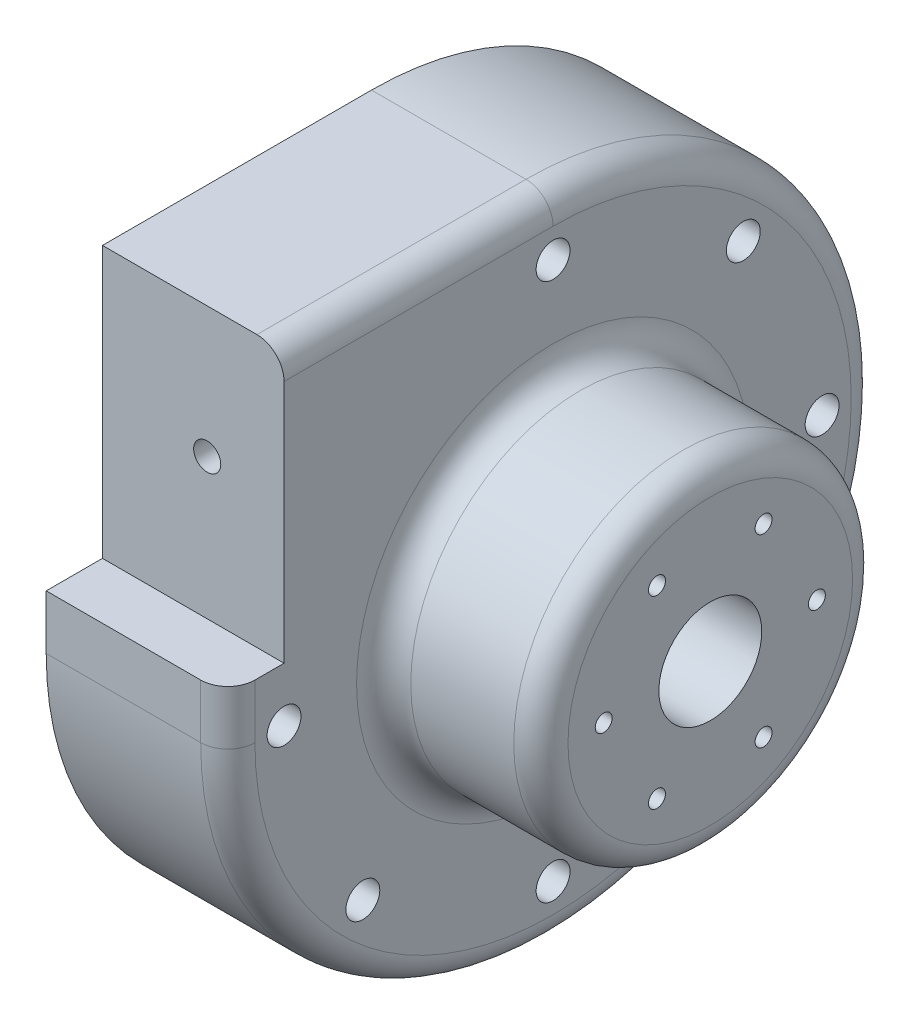
from build123d import *

# Parameters (mm, degrees)
HOUSING_2_DEPTH          = 44.45
SKETCH2_R                = 39.878
IMPELLER_CUT_DEPTH       = 22.4028
SKETCH4_R                = 9.641475923
INLET_CUT_DEPTH          = 19.8628
SKETCH6_R                = 3.175
FASTENER_BORE_DEPTH      = 116.84
FASTENER_PATTERN_COUNT   = 8
SKETCH7_R                = 100.114274451
SKETCH7_R_2              = 31.75
MASS_REDUCTION_CUT_DEPTH = 10.414
FILLET3_R                = 5.08
SKETCH8_W                = 34.036
SKETCH8_H                = 50.796537914
DISCHARGE_CUT_DEPTH      = 10.541
FILLET4_R                = 5.08
SKETCH9_R                = 2.54
DISCHARGE_BORE_DEPTH     = 50.038
SKETCH11_R               = 31.75
SKETCH11_R_2             = 9.641475923
BOSS_EXTRUDE1_DEPTH      = 19.05
SKETCH12_R               = 1.5875
CUT_EXTRUDE1_DEPTH       = 19.05
CIRPATTERN1_COUNT        = 6
FILLET6_R                = 5.08


with BuildPart() as part:
    # Sketch1 → Housing 2 (new body)
    with BuildSketch(Plane(origin=(0, 0, 0), x_dir=(0, 0, -1), z_dir=(1, 0, 0))):
        with BuildLine():
            Line((-60.96, 0), (-60.96, 60.96))
            Line((-60.96, 60.96), (0, 60.96))
            ThreePointArc((0, 60.96), (43.105229381, -43.105229381), (-60.96, 0))
        make_face()
    extrude(amount=HOUSING_2_DEPTH)

    # Sketch2 → Impeller Cut (cut)
    with BuildSketch(Plane.ZY):
        Circle(SKETCH2_R)
    extrude(amount=-IMPELLER_CUT_DEPTH, mode=Mode.SUBTRACT)

    # Sketch3 → Impeller Angle Cut (revolve, cut)
    with BuildSketch(Plane.XY, mode=Mode.PRIVATE) as impeller_angle_cut_sk:
        Polygon((29.602825054, 9.641475923), (22.4028, 39.878), (22.225, 0), (29.602825054, 0), align=None)
    revolve(impeller_angle_cut_sk.sketch.rotate(Axis((22.225, 0, 0), (1, 0, 0)), 180), axis=Axis((22.225, 0, 0), (1, 0, 0)), mode=Mode.SUBTRACT)

    # Sketch4 → Inlet Cut (cut)
    with BuildSketch(Plane.ZY.offset(-29.602825054)):
        with Locations(Location((0, 0, 0), (0, 0, 270))):
            Circle(SKETCH4_R)
    extrude(amount=-INLET_CUT_DEPTH, mode=Mode.SUBTRACT)

    # Sketch6 → Fastener Bore (cut)
    with BuildSketch(Plane(origin=(44.45, 0, 0), x_dir=(0, 0, -1), z_dir=(1, 0, 0))):
        with Locations((50.419, 0)):
            Circle(SKETCH6_R)
    fastener_bore = extrude(amount=-FASTENER_BORE_DEPTH, mode=Mode.SUBTRACT)

    # Fastener Pattern: Fastener Bore ×8 about axis, 1 skipped
    fastener_pattern_axis = Axis((0, 0, 0), (-1, 0, 0))
    add([fastener_bore.rotate(fastener_pattern_axis, i * 360 / FASTENER_PATTERN_COUNT) for i in range(1, FASTENER_PATTERN_COUNT) if i not in (5,)], mode=Mode.SUBTRACT)

    # Sketch7 → Mass Reduction Cut (cut)
    with BuildSketch(Plane(origin=(44.45, 0, 0), x_dir=(0, 0, -1), z_dir=(1, 0, 0))):
        Circle(SKETCH7_R)
        Circle(SKETCH7_R_2, mode=Mode.SUBTRACT)
    extrude(amount=-MASS_REDUCTION_CUT_DEPTH, mode=Mode.SUBTRACT)

    # Fillet3
    fillet3_edges = [part.edges().sort_by_distance(p)[0] for p in [
        (34.036, 0, 31.75),
    ]]
    fillet(fillet3_edges, radius=FILLET3_R)

    # Sketch8 → Discharge Cut (cut)
    with BuildSketch(Plane.XY.offset(60.96)):
        with Locations((17.018, 35.561731043)):
            Rectangle(SKETCH8_W, SKETCH8_H)
    extrude(amount=-DISCHARGE_CUT_DEPTH, mode=Mode.SUBTRACT)

    # Fillet4
    fillet4_edges = [part.edges().sort_by_distance(p)[0] for p in [
        (34.036, 5.081731043, 60.96),
        (34.036, -43.105229381, -43.105229381),
        (34.036, 60.96, 25.2095),
    ]]
    fillet(fillet4_edges, radius=FILLET4_R)

    # Sketch9 → Discharge Bore (cut)
    with BuildSketch(Plane.XY.offset(50.419)):
        with Locations((19.634252654, 36.501080952)):
            Circle(SKETCH9_R)
    extrude(amount=-DISCHARGE_BORE_DEPTH, mode=Mode.SUBTRACT)

    # Sketch11 → Boss-Extrude1 (add)
    with BuildSketch(Plane(origin=(44.45, 0, 0), x_dir=(0, 0, -1), z_dir=(1, 0, 0))):
        Circle(SKETCH11_R)
        with Locations(Location((0, 0, 0), (0, 0, 270))):
            Circle(SKETCH11_R_2, mode=Mode.SUBTRACT)
    extrude(amount=BOSS_EXTRUDE1_DEPTH)

    # Sketch12 → Cut-Extrude1 (cut)
    with BuildSketch(Plane(origin=(63.5, 0, 0), x_dir=(0, 0, -1), z_dir=(1, 0, 0))):
        with Locations((19.976045338, 0)):
            Circle(SKETCH12_R)
    cut_extrude1 = extrude(amount=-CUT_EXTRUDE1_DEPTH, mode=Mode.SUBTRACT)

    # CirPattern1: Cut-Extrude1 ×6 about axis
    cirpattern1_axis = Axis((0, 0, 0), (1, 0, 0))
    for i in range(1, CIRPATTERN1_COUNT):
        add(cut_extrude1.rotate(cirpattern1_axis, i * 360 / CIRPATTERN1_COUNT), mode=Mode.SUBTRACT)

    # Fillet6
    fillet6_edges = [part.edges().sort_by_distance(p)[0] for p in [
        (63.5, 0, 31.75),
    ]]
    fillet(fillet6_edges, radius=FILLET6_R)


solid = part.part
